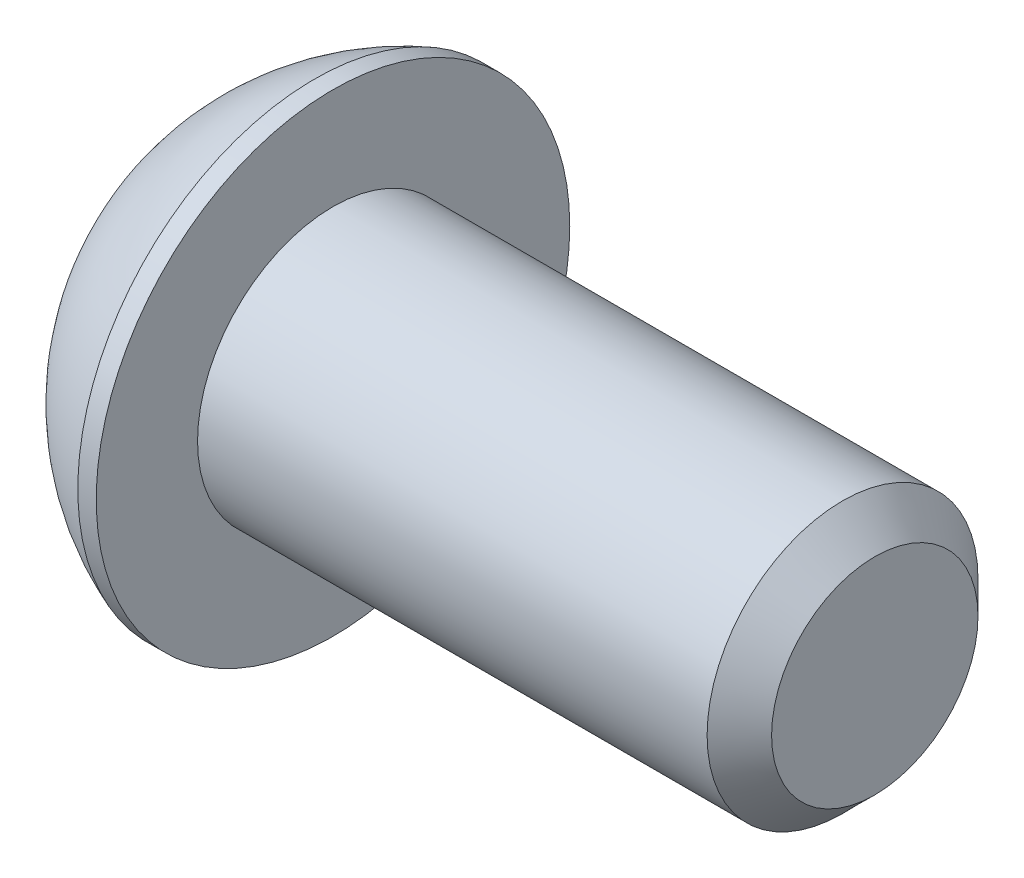
from build123d import *

# Parameters (mm, degrees)
SKETCH2_R           = 3.175
BOSS_EXTRUDE1_DEPTH = 12.7
CUT_EXTRUDE1_DEPTH  = 2.2225
CHAMFER1_SIZE       = 0.75565


with BuildPart() as part:
    # Sketch1 → Revolve1 (revolve)
    with BuildSketch(Plane.XY, mode=Mode.PRIVATE) as revolve1_sk:
        with BuildLine():
            Line((-3.3528, 3.175), (-3.3528, 0))
            Line((-3.3528, 0), (0, 0))
            Line((0, 0), (0, 5.5499))
            Line((0, 5.5499), (-0.4318, 5.5499))
            ThreePointArc((-0.4318, 5.5499), (-2.086170702, 4.600900596), (-3.3528, 3.175))
        make_face()
    revolve(revolve1_sk.sketch.rotate(Axis((-3.3528, 0, 0), (1, 0, 0)), 270), axis=Axis((-3.3528, 0, 0), (1, 0, 0)))

    # Sketch2 → Boss-Extrude1 (add)
    with BuildSketch(Plane(origin=(0, 0, 0), x_dir=(0, 0, -1), z_dir=(1, 0, 0))):
        Circle(SKETCH2_R)
    extrude(amount=BOSS_EXTRUDE1_DEPTH)

    # Sketch3 → Cut-Extrude1 (cut)
    with BuildSketch(Plane.ZY.offset(3.3528)):
        Polygon((2.291358881, 0), (1.14567944, 1.984375), (-1.14567944, 1.984375), (-2.291358881, 0), (-1.14567944, -1.984375), (1.14567944, -1.984375), align=None)
    extrude(amount=-CUT_EXTRUDE1_DEPTH, mode=Mode.SUBTRACT)

    # Chamfer1
    chamfer1_edges = [part.edges().sort_by_distance(p)[0] for p in [
        (12.7, 0, 3.175),
    ]]
    chamfer(chamfer1_edges, length=CHAMFER1_SIZE)


solid = part.part
